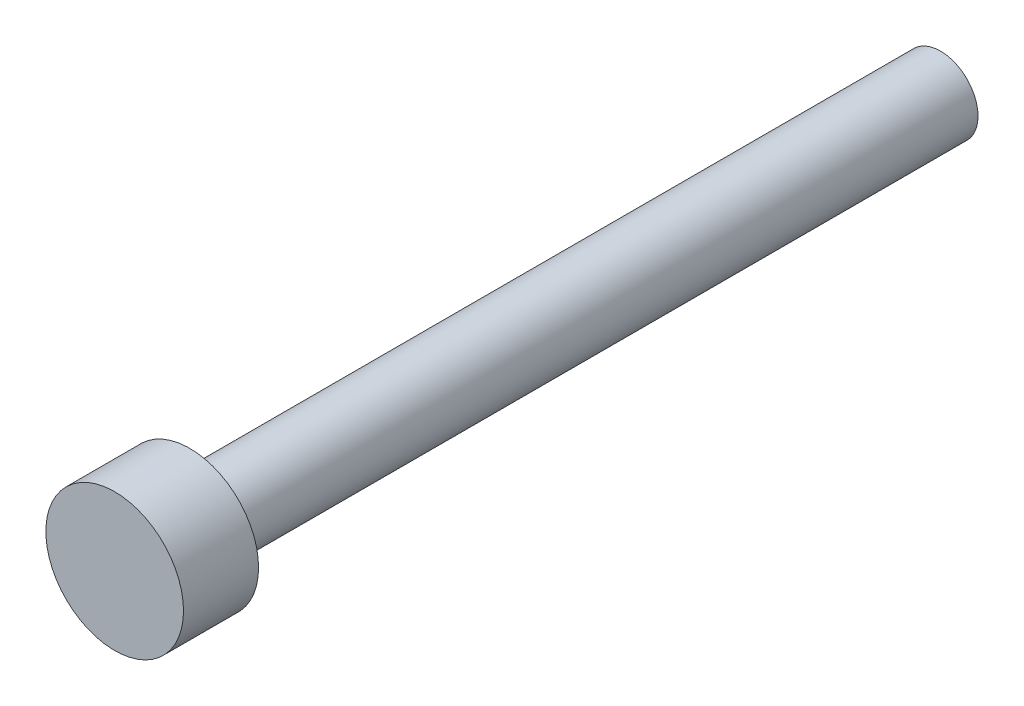
from build123d import *

# Parameters (mm, degrees)
SHANK_NOMINAL_THREAD_ENVELOPE_START     = -30
SHANK_NOMINAL_THREAD_ENVELOPE_PROFILE_R = 1.5
SHANK_NOMINAL_THREAD_ENVELOPE_DEPTH     = 30
SOCKET_HEAD_ENVELOPE_PROFILE_R          = 2.75
SOCKET_HEAD_ENVELOPE_DEPTH              = 3


with BuildPart() as part:
    # Shank_nominal_thread_envelope_profile → Shank_nominal_thread_envelope (new body)
    with BuildSketch(Plane.XY.offset(SHANK_NOMINAL_THREAD_ENVELOPE_START)):
        Circle(SHANK_NOMINAL_THREAD_ENVELOPE_PROFILE_R)
    extrude(amount=SHANK_NOMINAL_THREAD_ENVELOPE_DEPTH)

    # Socket_head_envelope_profile → Socket_head_envelope (add)
    with BuildSketch(Plane.XY):
        Circle(SOCKET_HEAD_ENVELOPE_PROFILE_R)
    extrude(amount=SOCKET_HEAD_ENVELOPE_DEPTH)


solid = part.part
